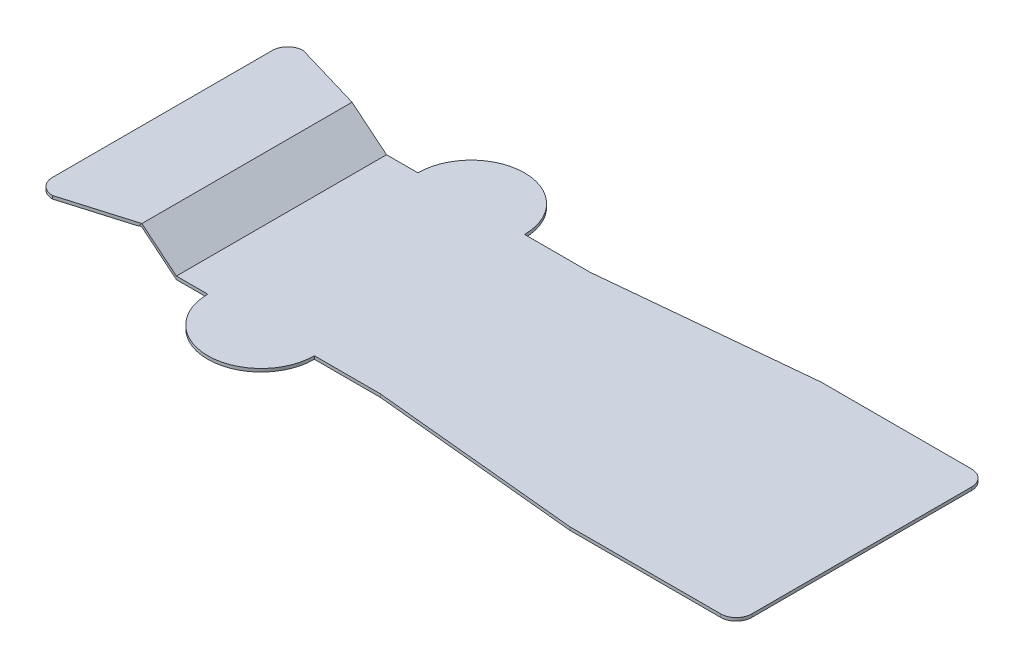
from build123d import *

# Parameters (mm, degrees)
SKETCH_1_W          = 223
SKETCH_1_H          = 80
EXTRUDE_1_DEPTH     = 10
SKETCH_3_OUTSIDE_W  = 272.426
SKETCH_3_OUTSIDE_H  = 59.426
CUT_EXTRUDE_1_DEPTH = 138.594512972
CUT_EXTRUDE_2_DEPTH = 119.879140306
CUT_EXTRUDE_3_DEPTH = 119.879140306
SKETCH_7_W          = 14.212670403
SKETCH_7_H          = 6.5
CUT_EXTRUDE_4_DEPTH = 153.966188104
SKETCH_9_W          = 65
SKETCH_9_H          = 6.5
CUT_EXTRUDE_6_DEPTH = 119.799200334
SKETCH_10_W         = 0.633237791
SKETCH_10_H         = 6.5
CUT_EXTRUDE_7_DEPTH = 154.59483235
CUT_EXTRUDE_8_DEPTH = 119.799200334
CUT_EXTRUDE_9_DEPTH = 119.799200334
EXTRUDE_2_DEPTH     = 1


with BuildPart() as part:
    # 스케치1 → 보스-돌출1 (new body)
    with BuildSketch(Plane(origin=(0, 0, 0), x_dir=(1, 0, 0), z_dir=(0, 1, 0))):
        Rectangle(SKETCH_1_W, SKETCH_1_H)
    extrude(amount=EXTRUDE_1_DEPTH)

    # 스케치3 outside → 컷-돌출1 (cut, through all)
    with BuildSketch(Plane.XY.offset(40)):
        with Locations((0, 5)):
            Rectangle(SKETCH_3_OUTSIDE_W, SKETCH_3_OUTSIDE_H)
        Polygon((-111.5, 10), (-111.5, 9), (-84.5, 9), (-73.5, 0), (111.5, 0), (111.5, 1), (-73.5, 1), (-84.5, 10), align=None, mode=Mode.SUBTRACT)
    extrude(amount=-CUT_EXTRUDE_1_DEPTH, mode=Mode.SUBTRACT)

    # 스케치5 → 컷-돌출2 (cut, through all)
    with BuildSketch(Plane(origin=(0, 10, 0), x_dir=(1, 0, 0), z_dir=(0, 1, 0))):
        with BuildLine():
            Line((-111.5, 40), (-111.5, 35.029307783))
            ThreePointArc((-111.5, 35.029307783), (-110.044117957, 38.544117957), (-106.529307783, 40))
            Line((-106.529307783, 40), (-111.5, 40))
        make_face()
        with BuildLine():
            ThreePointArc((-106.529307783, -40), (-110.044117957, -38.544117957), (-111.5, -35.029307783))
            Line((-111.5, -35.029307783), (-111.5, -40))
            Line((-111.5, -40), (-106.529307783, -40))
        make_face()
    extrude(amount=-CUT_EXTRUDE_2_DEPTH, mode=Mode.SUBTRACT)

    # 스케치6 → 컷-돌출3 (cut, through all)
    with BuildSketch(Plane(origin=(0, 10, 0), x_dir=(1, 0, 0), z_dir=(0, 1, 0))):
        Polygon((-106.529307783, 40), (-84.5, 33.5), (-84.5, 40), align=None)
        Polygon((-84.5, -40), (-84.5, -33.5), (-106.529307783, -40), align=None)
    extrude(amount=-CUT_EXTRUDE_3_DEPTH, mode=Mode.SUBTRACT)

    # 스케치7 → 컷-돌출4 (cut, through all)
    with BuildSketch(Plane(origin=(-28.982673267, -35.423267327, 0), x_dir=(0.7739572992033207, -0.6332377902572633, 0), z_dir=(0.6332377902572633, 0.7739572992033207, 0))):
        with Locations((-64.625434484, -36.75)):
            Rectangle(SKETCH_7_W, SKETCH_7_H)
        with Locations((-64.625434484, 36.75)):
            Rectangle(SKETCH_7_W, SKETCH_7_H)
    extrude(amount=-CUT_EXTRUDE_4_DEPTH, mode=Mode.SUBTRACT)

    # 스케치9 → 컷-돌출6 (cut, through all)
    with BuildSketch(Plane(origin=(0, 1, 0), x_dir=(1, 0, 0), z_dir=(0, 1, 0))):
        with Locations((-41, 36.75)):
            Rectangle(SKETCH_9_W, SKETCH_9_H)
        with Locations((-41, -36.75)):
            Rectangle(SKETCH_9_W, SKETCH_9_H)
    extrude(amount=-CUT_EXTRUDE_6_DEPTH, mode=Mode.SUBTRACT)

    # 스케치10 → 컷-돌출7 (cut, through all)
    with BuildSketch(Plane(origin=(-29.472772277, -36.022277228, 0), x_dir=(0.7739572992033206, -0.6332377902572633, 0), z_dir=(-0.6332377902572633, -0.7739572992033206, 0))):
        with Locations((-57.202480386, -36.75)):
            Rectangle(SKETCH_10_W, SKETCH_10_H)
        with Locations((-57.202480386, 36.75)):
            Rectangle(SKETCH_10_W, SKETCH_10_H)
    extrude(amount=-CUT_EXTRUDE_7_DEPTH, mode=Mode.SUBTRACT)

    # 스케치11 → 컷-돌출8 (cut, through all)
    with BuildSketch(Plane(origin=(0, 1, 0), x_dir=(1, 0, 0), z_dir=(0, 1, 0))):
        Polygon((-8.5, -40), (58.5, -40), (-8.5, -33.5), align=None)
        Polygon((-8.5, 33.5), (58.5, 40), (-8.5, 40), align=None)
    extrude(amount=-CUT_EXTRUDE_8_DEPTH, mode=Mode.SUBTRACT)

    # 스케치12 → 컷-돌출9 (cut, through all)
    with BuildSketch(Plane(origin=(0, 1, 0), x_dir=(1, 0, 0), z_dir=(0, 1, 0))):
        with BuildLine():
            Line((111.5, 40), (106.53, 40))
            ThreePointArc((106.53, 40), (110.044320702, 38.544320702), (111.5, 35.03))
            Line((111.5, 35.03), (111.5, 40))
        make_face()
        with BuildLine():
            Line((111.5, -40), (111.5, -35.03))
            ThreePointArc((111.5, -35.03), (110.044320702, -38.544320702), (106.53, -40))
            Line((106.53, -40), (111.5, -40))
        make_face()
    extrude(amount=-CUT_EXTRUDE_9_DEPTH, mode=Mode.SUBTRACT)

    # 스케치13 → 보스-돌출2 (add)
    with BuildSketch(Plane(origin=(0, 1, 0), x_dir=(1, 0, 0), z_dir=(0, 1, 0))):
        with BuildLine():
            Line((-29.5, 33.5), (-63.5, 33.5))
            ThreePointArc((-63.5, 33.5), (-46.5, 16.5), (-29.5, 33.5))
        make_face()
        with BuildLine():
            ThreePointArc((-29.5, 33.5), (-46.5, 50.5), (-63.5, 33.5))
            Line((-63.5, 33.5), (-29.5, 33.5))
        make_face()
        with BuildLine():
            ThreePointArc((-29.5, -33.5), (-46.5, -16.5), (-63.5, -33.5))
            Line((-63.5, -33.5), (-29.5, -33.5))
        make_face()
        with BuildLine():
            Line((-29.5, -33.5), (-63.5, -33.5))
            ThreePointArc((-63.5, -33.5), (-46.5, -50.5), (-29.5, -33.5))
        make_face()
    extrude(amount=-EXTRUDE_2_DEPTH)


solid = part.part
